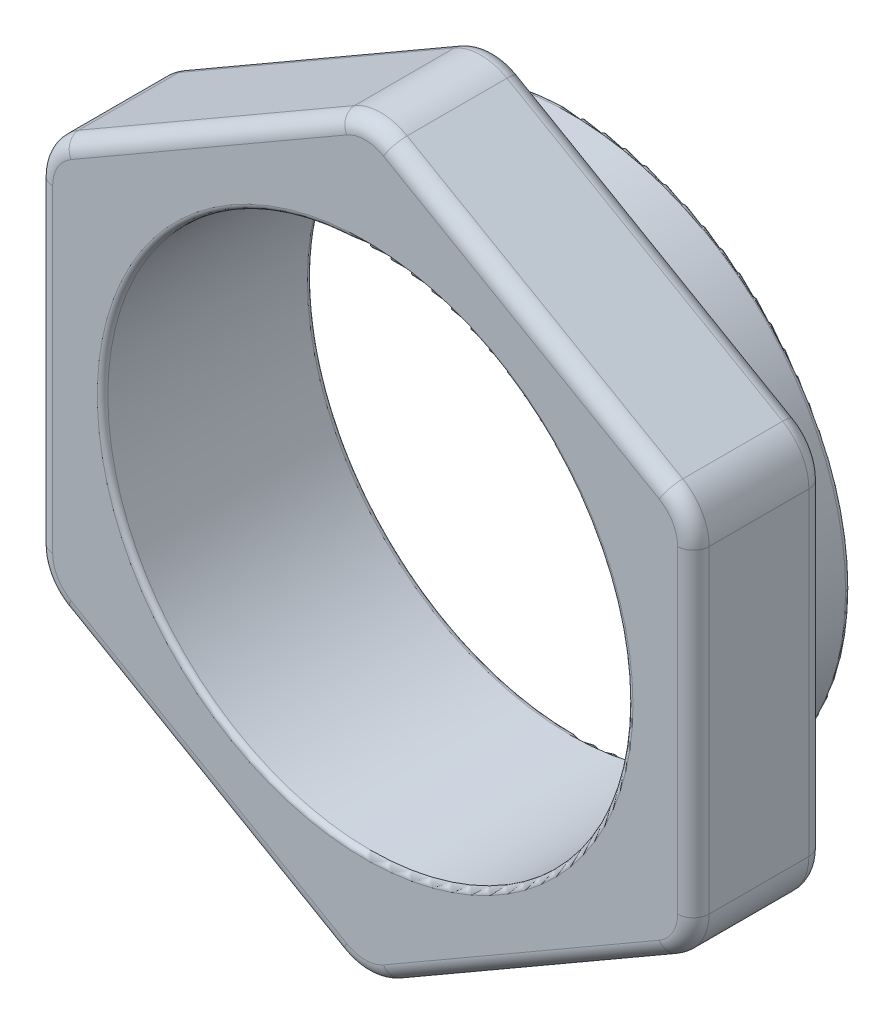
from build123d import *

# Parameters (mm, degrees)
SKETCH1_R           = 6.6675
BOSS_EXTRUDE1_DEPTH = 1.905
BOSS_EXTRUDE2_DEPTH = 3.175
SKETCH3_R           = 6.35
CUT_EXTRUDE1_DEPTH  = 14.145931484
FILLET1_R           = 1.27
FILLET2_R           = 0.381
FILLET3_R           = 0.127


with BuildPart() as part:
    # Sketch1 → Boss-Extrude1 (new body)
    with BuildSketch(Plane.XY):
        with Locations(Location((0, 0, 0), (0, 0, 180))):
            Circle(SKETCH1_R)
    extrude(amount=BOSS_EXTRUDE1_DEPTH)

    # Sketch2 → Boss-Extrude2 (add)
    with BuildSketch(Plane.XY.offset(1.905)):
        Polygon((7.9375, 4.582717762), (0, 9.165435523), (-7.9375, 4.582717762), (-7.9375, -4.582717762), (0, -9.165435523), (7.9375, -4.582717762), align=None)
    extrude(amount=BOSS_EXTRUDE2_DEPTH)

    # Sketch3 → Cut-Extrude1 (cut, through all)
    with BuildSketch(Plane(origin=(0, 0, 0), x_dir=(-1, 0, 0), z_dir=(0, 0, -1))):
        Circle(SKETCH3_R)
    extrude(amount=-CUT_EXTRUDE1_DEPTH, mode=Mode.SUBTRACT)

    # Fillet1
    fillet1_edges = [part.edges().sort_by_distance(p)[0] for p in [
        (7.9375, 4.582717762, 3.4925),
        (0, 9.165435523, 3.4925),
        (-7.9375, 4.582717762, 3.4925),
        (-7.9375, -4.582717762, 3.4925),
        (0, -9.165435523, 3.4925),
        (7.9375, -4.582717762, 3.4925),
    ]]
    fillet(fillet1_edges, radius=FILLET1_R)

    # Fillet2
    fillet2_edges = [part.edges().sort_by_distance(p)[0] for p in [
        (3.96875, 6.874076643, 1.905),
        (3.96875, 6.874076643, 5.08),
        (7.9375, 0, 1.905),
        (3.96875, -6.874076643, 1.905),
        (-3.96875, -6.874076643, 1.905),
        (-7.9375, 0, 1.905),
        (-3.96875, 6.874076643, 1.905),
        (0, 8.96896584, 1.905),
        (-7.767352263, 4.48448292, 1.905),
        (-7.767352263, -4.48448292, 1.905),
        (0, -8.96896584, 1.905),
        (7.767352263, -4.48448292, 1.905),
        (7.767352263, 4.48448292, 1.905),
        (7.9375, 0, 5.08),
        (-3.96875, 6.874076643, 5.08),
        (-7.9375, 0, 5.08),
        (-3.96875, -6.874076643, 5.08),
        (3.96875, -6.874076643, 5.08),
        (0, 8.96896584, 5.08),
        (-7.767352263, 4.48448292, 5.08),
        (-7.767352263, -4.48448292, 5.08),
        (0, -8.96896584, 5.08),
        (7.767352263, -4.48448292, 5.08),
        (7.767352263, 4.48448292, 5.08),
    ]]
    fillet(fillet2_edges, radius=FILLET2_R)

    # Fillet3
    fillet3_edges = [part.edges().sort_by_distance(p)[0] for p in [
        (6.6675, 0, 0),
        (6.35, 0, 5.08),
        (6.35, 0, 0),
    ]]
    fillet(fillet3_edges, radius=FILLET3_R)


solid = part.part
